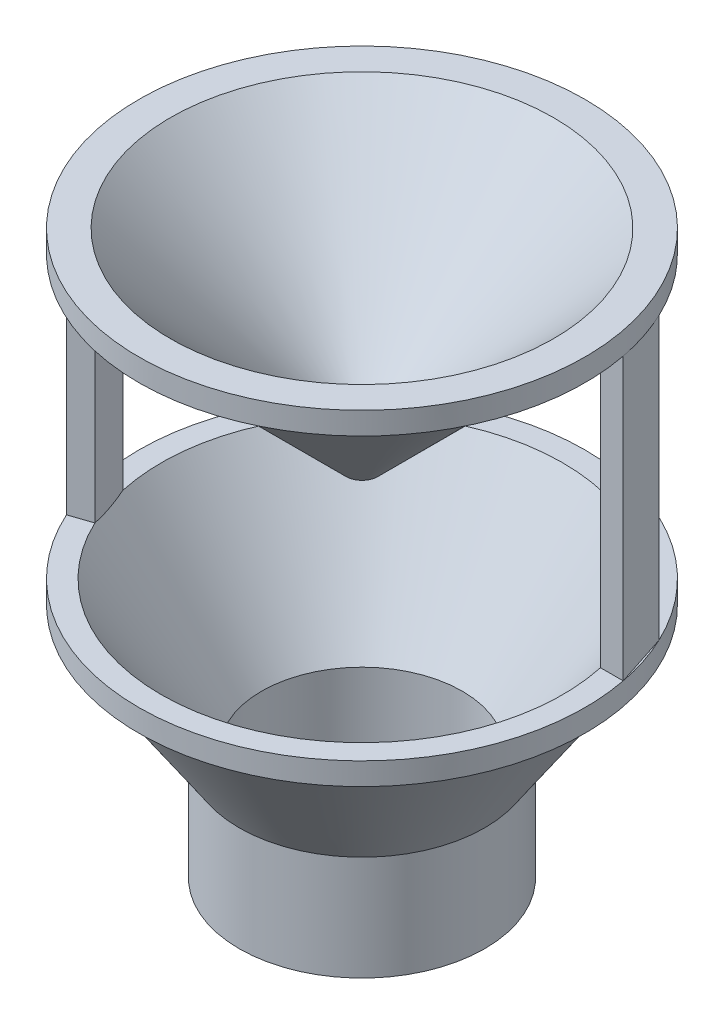
from build123d import *

# Parameters (mm, degrees)
BOSS_EXTRUDE1_DEPTH = 26


with BuildPart() as part:
    # Sketch1 → Revolve-Thin3 (revolve)
    with BuildSketch(Plane.XY, mode=Mode.PRIVATE) as revolve_thin3_sk:
        Polygon((-20, 13.228756555), (-18, 13.228756555), (-9, 0), (-9, -10), (-11, -10), (-11, -0.615831877), (-19.058300524, 11.228756555), (-20, 11.228756555), align=None)
    revolve(revolve_thin3_sk.sketch.rotate(Axis((0, 0, 0), (0, 1, 0)), 270), axis=Axis((0, 0, 0), (0, 1, 0)))



with BuildPart() as body_2:
    # Sketch5 → Revolve-Thin5 (revolve)
    with BuildSketch(Plane.XY, mode=Mode.PRIVATE) as revolve_thin5_sk:
        Polygon((1.428130018, 21.872546541), (18, 38.444416522), (20, 38.444416522), (20, 40.444416522), (17.171572875, 40.444416522), (0.013916456, 23.286760103), align=None)
    revolve(revolve_thin5_sk.sketch.rotate(Axis((0, 0, 0), (0, 1, 0)), 270), axis=Axis((0, 0, 0), (0, 1, 0)))


with BuildPart() as part_1:
    add(part.part)

    add(body_2.part)  # Boss-Extrude1 merges body 2
    # Sketch7 → Boss-Extrude1 (add)
    with BuildSketch(Plane.XZ.offset(-38.444416522)):
        Polygon((-18.203416664, 8.284661837), (-16.298741538, 7.638784214), (-17.583300095, 3.850656798), (-19.487975221, 4.496534421), align=None)
        Polygon((17.046573369, -5.780513503), (16.231562144, -7.780513503), (18.0866902, -8.536488599), (19.639442906, -3.780513503), (17.598514643, -3.780513503), align=None)
    extrude(amount=BOSS_EXTRUDE1_DEPTH)


solid = part_1.part
